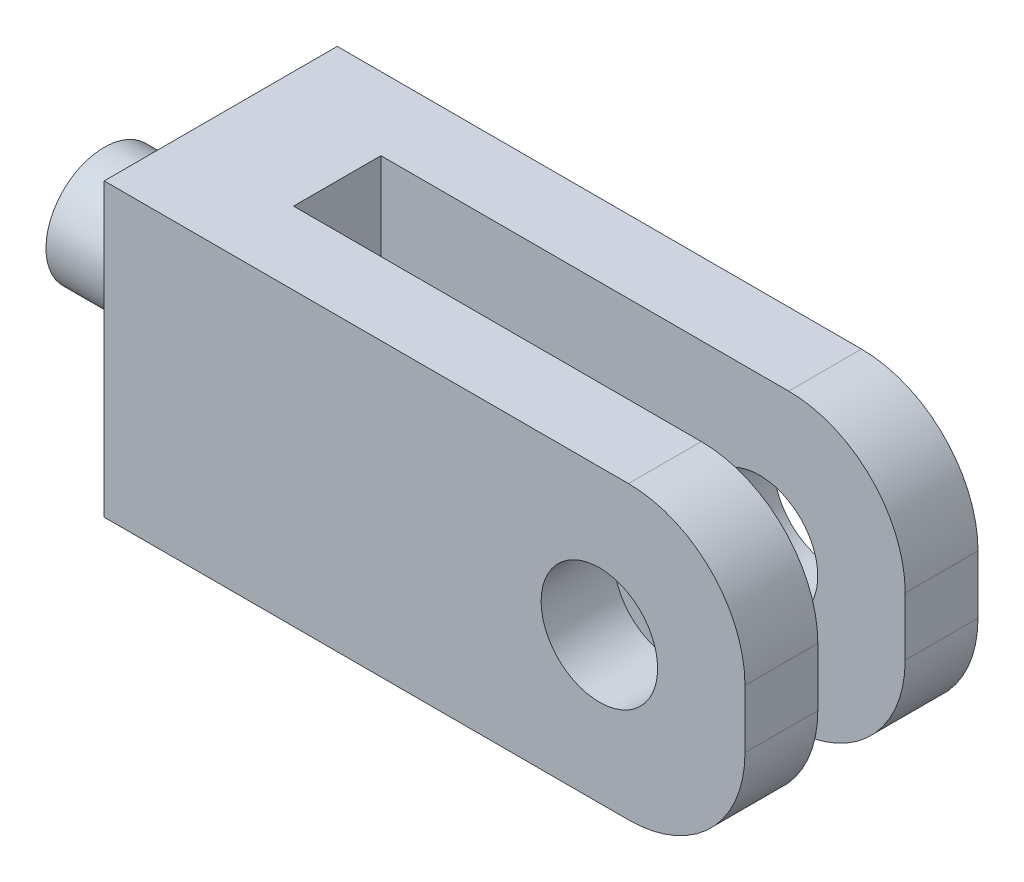
from build123d import *

# Parameters (mm, degrees)
SKETCH1_W           = 110
SKETCH1_H           = 50
BOSS_EXTRUDE1_DEPTH = 40
SKETCH2_W           = 15
SKETCH2_H           = 50
CUT_EXTRUDE1_DEPTH  = 90
FILLET1_R           = 20
SKETCH3_R           = 10
CUT_EXTRUDE2_DEPTH  = 90
SKETCH4_R           = 10
BOSS_EXTRUDE2_DEPTH = 20


with BuildPart() as part:
    # Sketch1 → Boss-Extrude1 (new body)
    with BuildSketch(Plane.XY):
        Rectangle(SKETCH1_W, SKETCH1_H)
    extrude(amount=BOSS_EXTRUDE1_DEPTH)

    # Sketch2 → Cut-Extrude1 (cut)
    with BuildSketch(Plane(origin=(55, 0, 0), x_dir=(0, 0, -1), z_dir=(1, 0, 0))):
        with Locations((-20, 0)):
            Rectangle(SKETCH2_W, SKETCH2_H)
    extrude(amount=-CUT_EXTRUDE1_DEPTH, mode=Mode.SUBTRACT)

    # Fillet1
    fillet1_edges = [part.edges().sort_by_distance(p)[0] for p in [
        (55, -25, 6.25),
        (55, 25, 6.25),
        (55, -25, 33.75),
        (55, 25, 33.75),
    ]]
    fillet(fillet1_edges, radius=FILLET1_R)

    # Sketch3 → Cut-Extrude2 (cut)
    with BuildSketch(Plane(origin=(0, 0, 0), x_dir=(-1, 0, 0), z_dir=(0, 0, -1))):
        with Locations((-30, 0)):
            Circle(SKETCH3_R)
    extrude(amount=-CUT_EXTRUDE2_DEPTH, mode=Mode.SUBTRACT)

    # Sketch4 → Boss-Extrude2 (add)
    with BuildSketch(Plane.ZY.offset(55)):
        with Locations(Location((20, 0, 0), (0, 0, 270))):
            Circle(SKETCH4_R)
    extrude(amount=BOSS_EXTRUDE2_DEPTH)


solid = part.part
